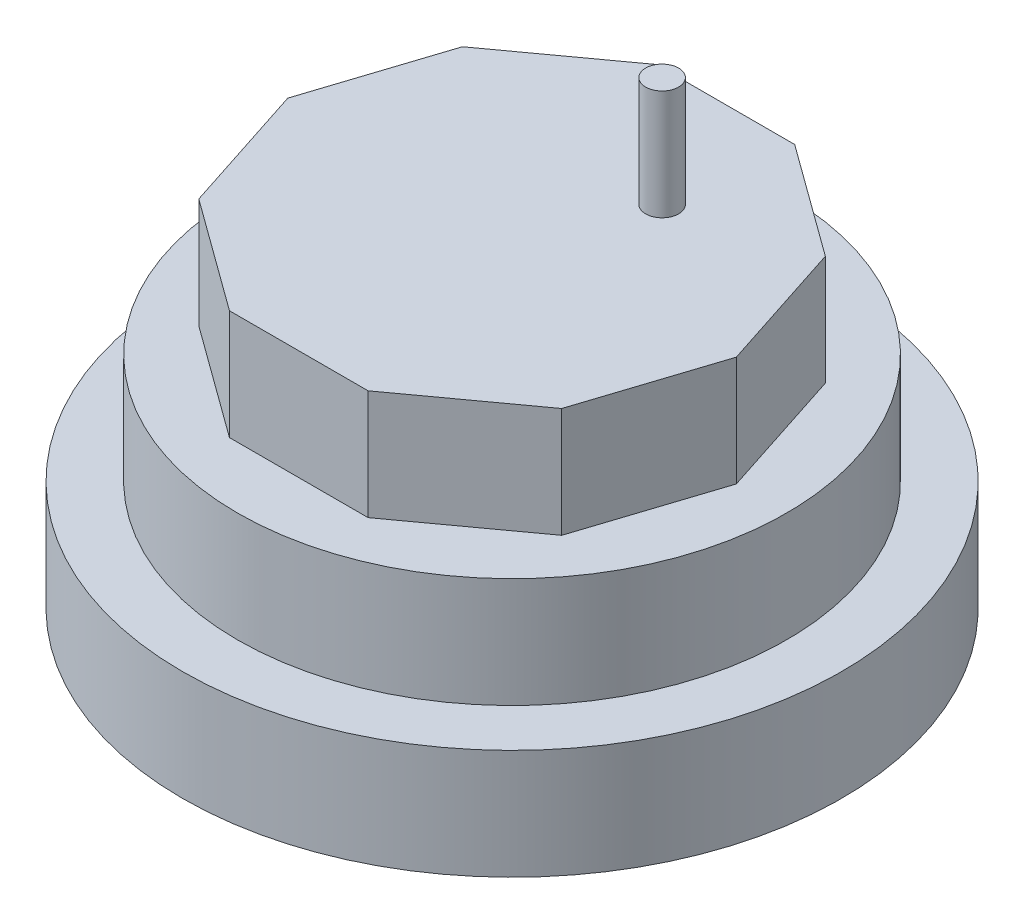
from build123d import *

# Parameters (mm, degrees)
SKETCH2_R           = 76.2
BOSS_EXTRUDE1_DEPTH = 25.4
SKETCH3_R           = 63.5
BOSS_EXTRUDE2_DEPTH = 25.4
BOSS_EXTRUDE3_DEPTH = 25.4
SKETCH5_R           = 3.81
BOSS_EXTRUDE4_DEPTH = 25.4


with BuildPart() as part:
    # Sketch2 → Boss-Extrude1 (new body)
    with BuildSketch(Plane(origin=(0, 0, 0), x_dir=(1, 0, 0), z_dir=(0, 1, 0))):
        with Locations(Location((0, 0, 0), (0, 0, 270))):
            Circle(SKETCH2_R)
    extrude(amount=BOSS_EXTRUDE1_DEPTH)

    # Sketch3 → Boss-Extrude2 (add)
    with BuildSketch(Plane(origin=(0, 25.4, 0), x_dir=(1, 0, 0), z_dir=(0, 1, 0))):
        with Locations(Location((0, 0, 0), (0, 0, 270))):
            Circle(SKETCH3_R)
    extrude(amount=BOSS_EXTRUDE2_DEPTH)

    # Sketch4 → Boss-Extrude3 (add)
    with BuildSketch(Plane(origin=(0, 50.8, 0), x_dir=(1, 0, 0), z_dir=(0, 1, 0))):
        Polygon((41.952120936, -30.48), (51.855673277, 0), (41.952120936, 30.48), (16.024284297, 49.317675977), (-16.024284297, 49.317675977), (-41.952120936, 30.48), (-51.855673277, 0), (-41.952120936, -30.48), (-16.024284297, -49.317675977), (16.024284297, -49.317675977), align=None)
    extrude(amount=BOSS_EXTRUDE3_DEPTH)

    # Sketch5 → Boss-Extrude4 (add)
    with BuildSketch(Plane(origin=(0, 76.2, 0), x_dir=(1, 0, 0), z_dir=(0, 1, 0))):
        with Locations(Location((12.7, 21.997045256, 0), (0, 0, 270))):
            Circle(SKETCH5_R)
    extrude(amount=BOSS_EXTRUDE4_DEPTH)


solid = part.part
